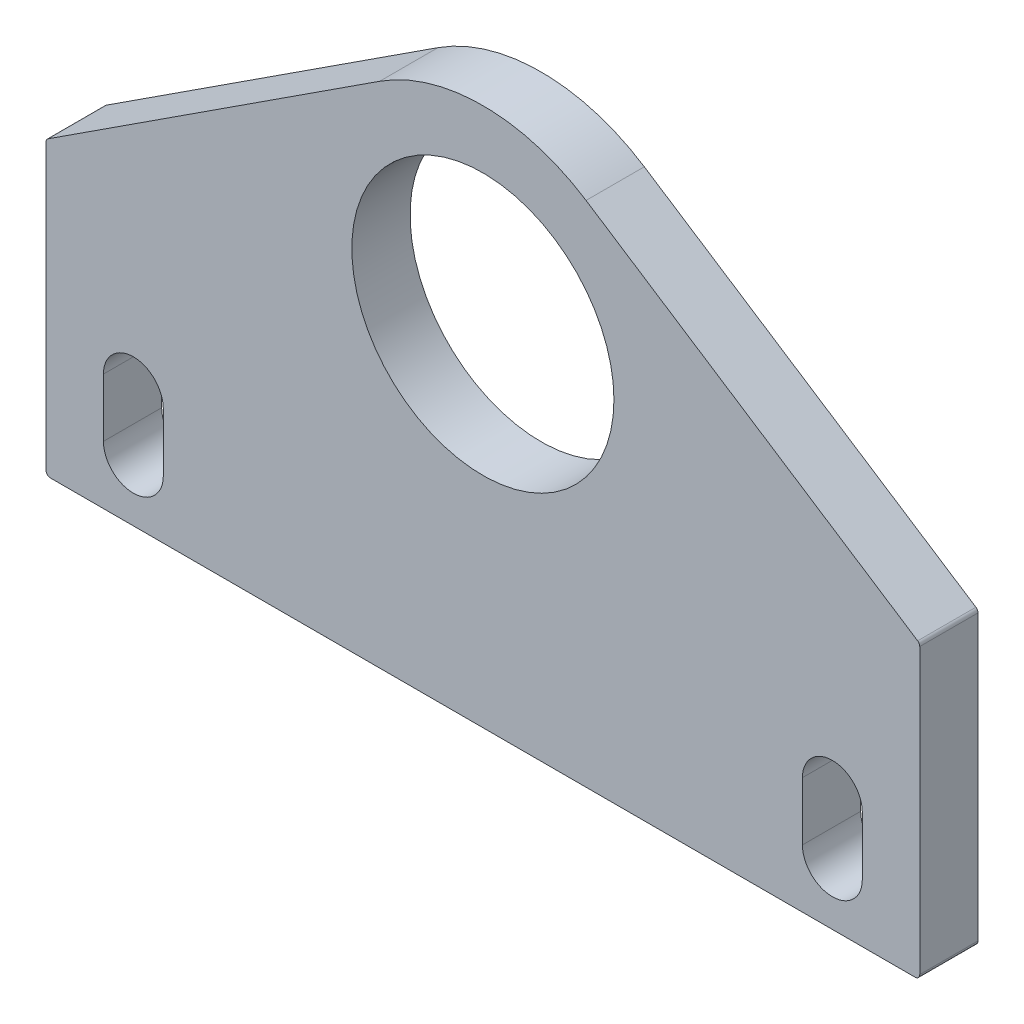
from build123d import *

# Parameters (mm, degrees)
SKETCH1_R           = 14.2875
BOSS_EXTRUDE1_DEPTH = 6.35
FILLET1_R           = 0.508


with BuildPart() as part:
    # Sketch1 → Boss-Extrude1 (new body)
    with BuildSketch(Plane.XY):
        with BuildLine():
            Line((-11.249807725, 17.301682936), (-47.625, -6.35))
            Line((-47.625, -6.35), (-47.625, -38.1))
            Line((-47.625, -38.1), (47.625, -38.1))
            Line((47.625, -38.1), (47.625, -6.35))
            Line((47.625, -6.35), (11.249807725, 17.301682936))
            ThreePointArc((11.249807725, 17.301682936), (0, 20.6375), (-11.249807725, 17.301682936))
        make_face()
        Circle(SKETCH1_R, mode=Mode.SUBTRACT)
        with BuildLine():
            Line((-34.8361, -25.4), (-34.8361, -31.75))
            ThreePointArc((-34.8361, -31.75), (-38.1, -35.0139), (-41.3639, -31.75))
            Line((-41.3639, -31.75), (-41.3639, -25.4))
            ThreePointArc((-41.3639, -25.4), (-38.1, -22.1361), (-34.8361, -25.4))
        make_face(mode=Mode.SUBTRACT)
        with BuildLine():
            Line((41.3639, -25.4), (41.3639, -31.75))
            ThreePointArc((41.3639, -31.75), (38.1, -35.0139), (34.8361, -31.75))
            Line((34.8361, -31.75), (34.8361, -25.4))
            ThreePointArc((34.8361, -25.4), (38.1, -22.1361), (41.3639, -25.4))
        make_face(mode=Mode.SUBTRACT)
    extrude(amount=BOSS_EXTRUDE1_DEPTH)

    # Fillet1
    fillet1_edges = [part.edges().sort_by_distance(p)[0] for p in [
        (47.625, -6.35, 3.175),
        (47.625, -38.1, 3.175),
        (-47.625, -38.1, 3.175),
        (-47.625, -6.35, 3.175),
    ]]
    fillet(fillet1_edges, radius=FILLET1_R)


solid = part.part
